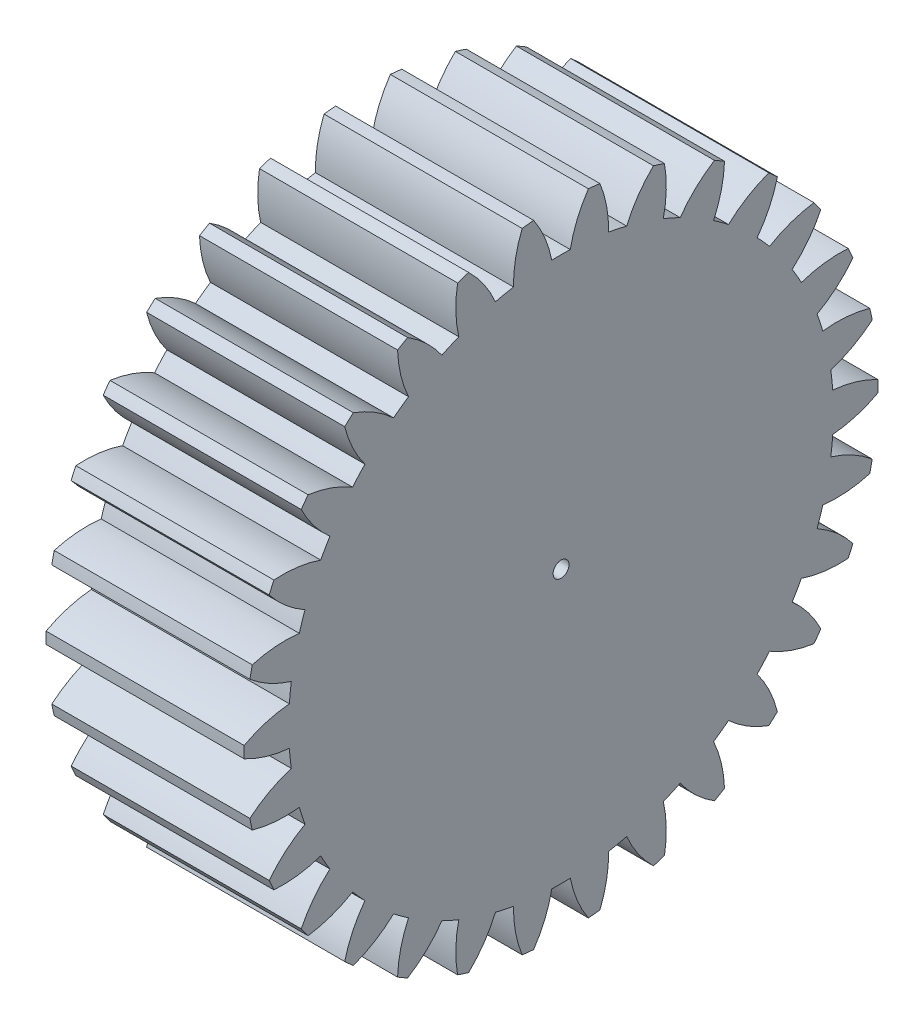
from build123d import *

# Parameters (mm, degrees)
BASPROSKE_W     = 10
BASPROSKE_H     = 16
TOOTHCUT_DEPTH  = 25.738633754
TEETHCUTS_COUNT = 30
TEETHCUTS_ANGLE = 348
BORSKE_R        = 0.4
BORE_DEPTH      = 50.0000508


with BuildPart() as part:
    # BasProSke → Base-Revolve (revolve)
    with BuildSketch(Plane(origin=(0, 0, 0), x_dir=(1, 0, 0), z_dir=(0, 1, 0)), mode=Mode.PRIVATE) as base_revolve_sk:
        with Locations((5, 8)):
            Rectangle(BASPROSKE_W, BASPROSKE_H)
    revolve(base_revolve_sk.sketch.rotate(Axis((-10, 0, 0), (1, 0, 0)), 180), axis=Axis((-10, 0, 0), (1, 0, 0)))

    # TooCutSke → ToothCut (cut, through all)
    with BuildSketch(Plane(origin=(0, 0, 0), x_dir=(0, 0, -1), z_dir=(1, 0, 0))):
        with BuildLine():
            ThreePointArc((0.466400716, 13.741086979), (0, 13.749), (-0.466400716, 13.741086979))
            ThreePointArc((-0.466400716, 13.741086979), (-0.819142092, 14.899954875), (-1.3974676, 15.964351834))
            ThreePointArc((-1.3974676, 15.964351834), (0, 16.0254), (1.3974676, 15.964351834))
            ThreePointArc((1.3974676, 15.964351834), (0.819142092, 14.899954875), (0.466400716, 13.741086979))
        make_face()
    toothcut = extrude(amount=TOOTHCUT_DEPTH, mode=Mode.SUBTRACT)

    # TeethCuts: ToothCut ×30 about axis
    teethcuts_axis = Axis((-10, 0, 0), (1, 0, 0))
    for i in range(1, TEETHCUTS_COUNT):
        add(toothcut.rotate(teethcuts_axis, i * TEETHCUTS_ANGLE / (TEETHCUTS_COUNT - 1)), mode=Mode.SUBTRACT)

    # BorSke → Bore (cut, symmetric)
    with BuildSketch(Plane(origin=(0, 0, 0), x_dir=(0, 0, -1), z_dir=(1, 0, 0))):
        with Locations(Location((0, 0, 0), (0, 0, 180))):
            Circle(BORSKE_R)
    extrude(amount=BORE_DEPTH, both=True, mode=Mode.SUBTRACT)


solid = part.part
